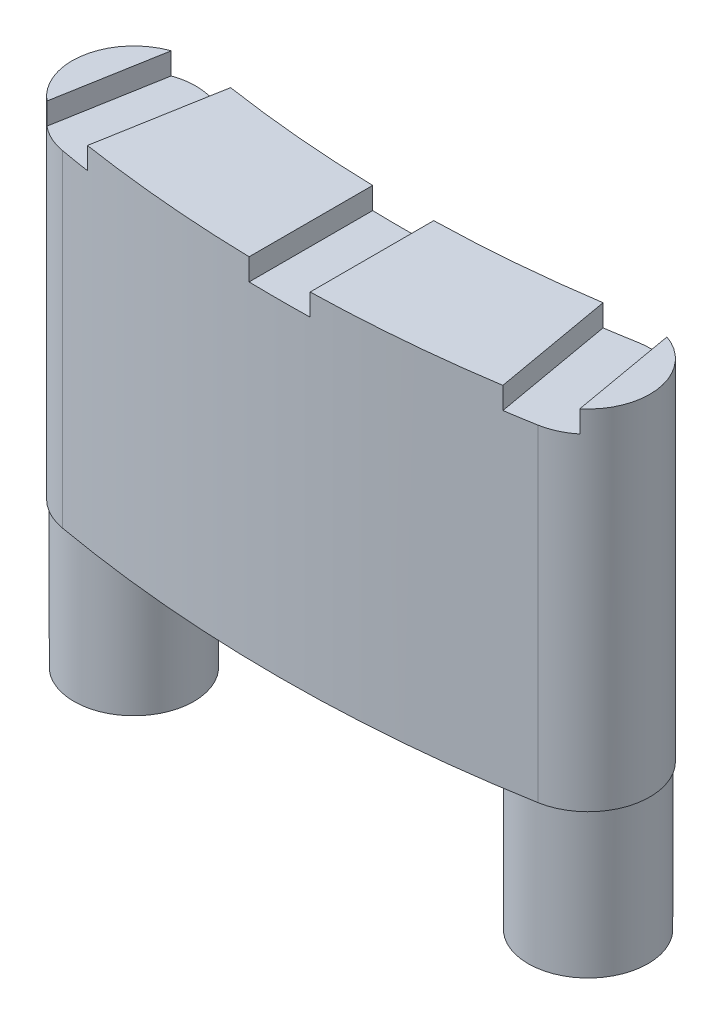
from build123d import *

# Parameters (mm, degrees)
BOSS_EXTRUDE1_DEPTH             = 24
SKETCH2_R                       = 4.125
BOSS_EXTRUDE2_DEPTH             = 10
CUT_EXTRUDE1_START              = -24
CUT_EXTRUDE1_DEPTH              = 1.5
CIRPATTERN1_COUNT               = 2
CIRPATTERN1_ANGLE               = 10
CIRPATTERN1_THE_OTHER_WAY_COUNT = 2
CIRPATTERN1_THE_OTHER_WAY_ANGLE = 10


with BuildPart() as part:
    # Sketch1 → Boss-Extrude1 (new body)
    with BuildSketch(Plane(origin=(0, 0, 0), x_dir=(1, 0, 0), z_dir=(0, 1, 0))):
        with BuildLine():
            ThreePointArc((-16.361099339, -0.997559555), (0, -2.429428688), (16.361258496, -0.999379302))
            ThreePointArc((16.361258496, -0.999379302), (19.819023, 3.925881002), (14.885248975, 7.371486655))
            ThreePointArc((14.885248975, 7.371486655), (0, 6.070571326), (-14.885089829, 7.373306345))
            ThreePointArc((-14.885089829, 7.373306345), (-19.808527535, 3.92587815), (-16.361099339, -0.997559555))
        make_face()
    extrude(amount=BOSS_EXTRUDE1_DEPTH)

    # Sketch2 → Boss-Extrude2 (add)
    with BuildSketch(Plane.XZ):
        with Locations(Location((-15.623094584, -3.187873395, 0), (0, 0, 90))):
            Circle(SKETCH2_R)
        with Locations(Location((15.633577289, -3.187873997, 0), (0, 0, 90))):
            Circle(SKETCH2_R)
    extrude(amount=BOSS_EXTRUDE2_DEPTH)

    # Sketch4 → Cut-Extrude1 (cut)
    with BuildSketch(Plane.XZ.offset(CUT_EXTRUDE1_START)):
        with BuildLine():
            Line((-2.1, 2.405913745), (-2.1, -6.140590357))
            ThreePointArc((-2.1, -6.140590357), (-0.000388897, -6.081612393), (2.1, -6.096161069))
            Line((2.1, -6.096161069), (2.1, 2.406147372))
            ThreePointArc((2.1, 2.406147372), (-3.4179e-05, 3.020482466), (-2.1, 2.405913745))
        make_face()
    cut_extrude1 = extrude(amount=CUT_EXTRUDE1_DEPTH, mode=Mode.SUBTRACT)

    # CirPattern1: Cut-Extrude1 ×2 about axis
    cirpattern1_axis = Axis((0.005241406, 24, -91.820571166), (0, 1, 0))
    for i in range(1, CIRPATTERN1_COUNT):
        add(cut_extrude1.rotate(cirpattern1_axis, i * CIRPATTERN1_ANGLE / (CIRPATTERN1_COUNT - 1)), mode=Mode.SUBTRACT)

    # CirPattern1 the other way: Cut-Extrude1 ×2 about axis
    cirpattern1_the_other_way_axis = Axis((0.005241406, 24, -91.820571166), (0, -1, 0))
    for i in range(1, CIRPATTERN1_THE_OTHER_WAY_COUNT):
        add(cut_extrude1.rotate(cirpattern1_the_other_way_axis, i * CIRPATTERN1_THE_OTHER_WAY_ANGLE / (CIRPATTERN1_THE_OTHER_WAY_COUNT - 1)), mode=Mode.SUBTRACT)


solid = part.part
